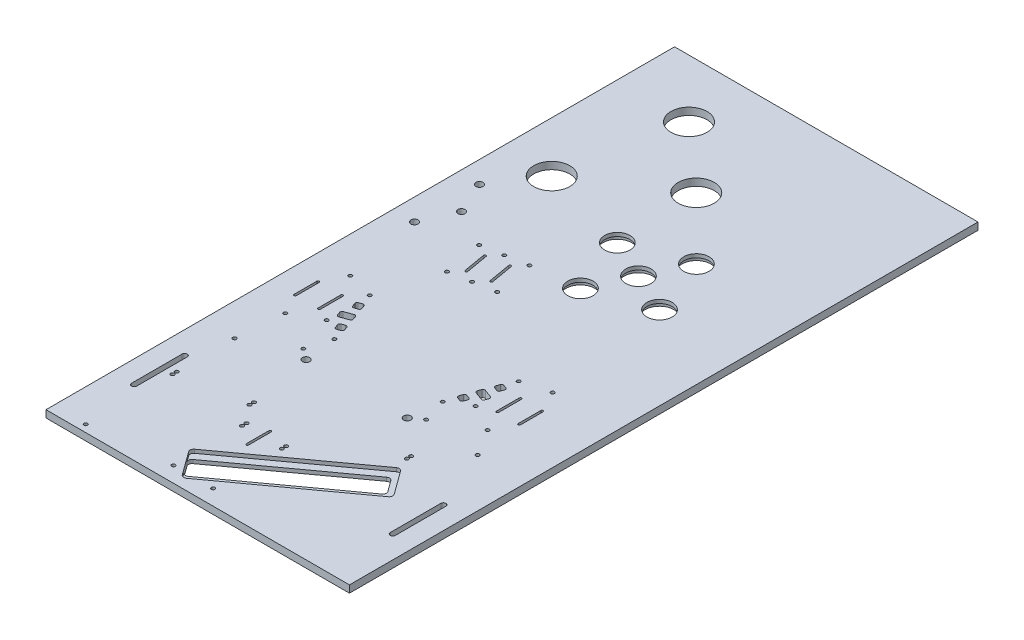
from build123d import *

# Parameters (mm, degrees)
SKETCH1_W                               = 533.4
SKETCH1_H                               = 1104.9
BOSS_EXTRUDE1_DEPTH                     = 12.7
LAUNCH_SYSTEM_MOUNTING_HOLES_AT_2_COUNT = 2
LAUNCH_SYSTEM_MOUNTING_HOLES_AT_2_PITCH = 44.45
LAUNCH_SYSTEM_MOUNTING_HOLES_AT_3_COUNT = 2
LAUNCH_SYSTEM_MOUNTING_HOLES_AT_3_PITCH = 88.9
LAUNCH_SYSTEM_MOUNTING_HOLES_AT_4_COUNT = 2
LAUNCH_SYSTEM_MOUNTING_HOLES_AT_4_PITCH = 94.399536545
LAUNCH_SYSTEM_MOUNTING_HOLES_AT_5_COUNT = 2
LAUNCH_SYSTEM_MOUNTING_HOLES_AT_5_PITCH = 54.624765446
LAUNCH_SYSTEM_MOUNTING_HOLES_AT_6_COUNT = 2
LAUNCH_SYSTEM_MOUNTING_HOLES_AT_6_PITCH = 31.761123779
CUT_EXTRUDE1_DEPTH                      = 1227.980382891
CUT_EXTRUDE2_DEPTH                      = 6.35
CUT_EXTRUDE3_DEPTH                      = 1227.931087103
SKETCH11_R                              = 6.35
CUT_EXTRUDE4_DEPTH                      = 1227.980382891
SKETCH13_R                              = 31.75
CUT_EXTRUDE5_DEPTH                      = 1227.980382891
SKETCH14_R                              = 3.175
CUT_EXTRUDE6_DEPTH                      = 1227.980382891
FILLET1_R                               = 3.175
SKETCH15_R                              = 3.175
CUT_EXTRUDE7_DEPTH                      = 1227.980382891
SKETCH16_R                              = 3.175
CUT_EXTRUDE8_DEPTH                      = 1227.980382891
SKETCH17_R                              = 3.175
CUT_EXTRUDE9_DEPTH                      = 1227.980382891
SKETCH18_R                              = 3.175
CUT_EXTRUDE10_DEPTH                     = 1227.980382891
SKETCH19_R                              = 3.175
CUT_EXTRUDE11_DEPTH                     = 1227.980382891
SKETCH20_R                              = 3.175
CUT_EXTRUDE12_DEPTH                     = 1227.980382891
SKETCH21_R                              = 6.35
CUT_EXTRUDE13_DEPTH                     = 1227.980382891
SKETCH22_R                              = 22.225
CUT_EXTRUDE14_DEPTH                     = 1227.980382891
SKETCH23_R                              = 25.4
CUT_EXTRUDE15_DEPTH                     = 6.35
CUT_EXTRUDE16_DEPTH                     = 22.098
CUT_EXTRUDE17_DEPTH                     = 1227.980382891
CUT_EXTRUDE18_DEPTH                     = 72.136
CUT_EXTRUDE19_DEPTH                     = 72.136
SKETCH28_R                              = 3.175
CUT_EXTRUDE20_DEPTH                     = 28.194


with BuildPart() as part:
    # Sketch1 → Boss-Extrude1 (new body)
    with BuildSketch(Plane(origin=(0, 0, 0), x_dir=(1, 0, 0), z_dir=(0, 1, 0))):
        with Locations((266.7, 552.45)):
            Rectangle(SKETCH1_W, SKETCH1_H)
    extrude(amount=BOSS_EXTRUDE1_DEPTH)

    # Sketch5 → Launch system mounting holes (revolve, cut)
    with BuildSketch(Plane(origin=(509.905, 0, -19.05), x_dir=(0, 0, -1), z_dir=(1, 0, 0))):
        Polygon((0, 0), (0, 11.705806461), (1.7272, 10.668), (1.7272, 0), align=None)
    launch_system_mounting_holes = revolve(axis=Axis((509.905, -6.35, -19.05), (0, 1, 0)), mode=Mode.SUBTRACT)

    # Launch system mounting holes at 2: Launch system mounting holes ×2
    with Locations(*[(0, 0, -i * LAUNCH_SYSTEM_MOUNTING_HOLES_AT_2_PITCH) for i in range(1, LAUNCH_SYSTEM_MOUNTING_HOLES_AT_2_COUNT)]):
        add(launch_system_mounting_holes, mode=Mode.SUBTRACT)

    # Launch system mounting holes at 3: Launch system mounting holes ×2
    with Locations(*[(0, 0, -i * LAUNCH_SYSTEM_MOUNTING_HOLES_AT_3_PITCH) for i in range(1, LAUNCH_SYSTEM_MOUNTING_HOLES_AT_3_COUNT)]):
        add(launch_system_mounting_holes, mode=Mode.SUBTRACT)

    # Launch system mounting holes at 4: Launch system mounting holes ×2
    with Locations(*[Vector(-0.3363363969981552, 0, -0.9417419115948379) * (i * LAUNCH_SYSTEM_MOUNTING_HOLES_AT_4_PITCH) for i in range(1, LAUNCH_SYSTEM_MOUNTING_HOLES_AT_4_COUNT)]):
        add(launch_system_mounting_holes, mode=Mode.SUBTRACT)

    # Launch system mounting holes at 5: Launch system mounting holes ×2
    with Locations(*[Vector(-0.5812381937190976, 0, -0.8137334712067341) * (i * LAUNCH_SYSTEM_MOUNTING_HOLES_AT_5_PITCH) for i in range(1, LAUNCH_SYSTEM_MOUNTING_HOLES_AT_5_COUNT)]):
        add(launch_system_mounting_holes, mode=Mode.SUBTRACT)

    # Launch system mounting holes at 6: Launch system mounting holes ×2
    with Locations(*[Vector(-0.9996497674567271, 0, -0.026463983519332806) * (i * LAUNCH_SYSTEM_MOUNTING_HOLES_AT_6_PITCH) for i in range(1, LAUNCH_SYSTEM_MOUNTING_HOLES_AT_6_COUNT)]):
        add(launch_system_mounting_holes, mode=Mode.SUBTRACT)

    # Sketch6 → Cut-Extrude1 (cut, through all)
    with BuildSketch(Plane(origin=(0, 0, 0), x_dir=(-1, 0, 0), z_dir=(0, -1, 0))):
        with BuildLine():
            Line((-498.475, 115.57), (-498.475, 204.47))
            ThreePointArc((-498.475, 204.47), (-494.03, 208.915), (-489.585, 204.47))
            Line((-489.585, 204.47), (-489.585, 115.57))
            ThreePointArc((-489.585, 115.57), (-494.03, 111.125), (-498.475, 115.57))
        make_face()
    cut_extrude1 = extrude(amount=-CUT_EXTRUDE1_DEPTH, mode=Mode.SUBTRACT)

    # Sketch9 → Cut-Extrude2 (cut)
    with BuildSketch(Plane(origin=(0, 12.7, 0), x_dir=(1, 0, 0), z_dir=(0, 1, 0))):
        with BuildLine():
            Line((396.125138133, 219.720033225), (190.634821562, 70.422579143))
            ThreePointArc((190.634821562, 70.422579143), (188.095436952, 66.278680082), (189.23, 61.552884876))
            Line((189.23, 61.552884876), (219.089490816, 20.454821562))
            ThreePointArc((219.089490816, 20.454821562), (223.233389878, 17.915436952), (227.959185083, 19.05))
            Line((227.959185083, 19.05), (433.449501654, 168.347454082))
            ThreePointArc((433.449501654, 168.347454082), (435.988886265, 172.491353144), (434.854323216, 177.217148349))
            Line((434.854323216, 177.217148349), (404.9948324, 218.315211663))
            ThreePointArc((404.9948324, 218.315211663), (400.850933339, 220.854596274), (396.125138133, 219.720033225))
        make_face()
    extrude(amount=-CUT_EXTRUDE2_DEPTH, mode=Mode.SUBTRACT)

    # Sketch10 → Cut-Extrude3 (cut, through all)
    with BuildSketch(Plane(origin=(0, 6.35, 0), x_dir=(1, 0, 0), z_dir=(0, 1, 0))):
        with BuildLine():
            Line((197.068116339, 50.764643256), (211.251374477, 31.243063182))
            ThreePointArc((211.251374477, 31.243063182), (215.395273538, 28.703678571), (220.121068743, 29.83824162))
            Line((220.121068743, 29.83824162), (417.391772652, 173.163797539))
            ThreePointArc((417.391772652, 173.163797539), (419.931157263, 177.3076966), (418.796594214, 182.033491805))
            Line((418.796594214, 182.033491805), (404.613336076, 201.55507188))
            ThreePointArc((404.613336076, 201.55507188), (400.469437015, 204.09445649), (395.74364181, 202.959893442))
            Line((395.74364181, 202.959893442), (198.472937902, 59.634337523))
            ThreePointArc((198.472937902, 59.634337523), (195.933553291, 55.490438462), (197.068116339, 50.764643256))
        make_face()
    extrude(amount=-CUT_EXTRUDE3_DEPTH, mode=Mode.SUBTRACT)

    # Sketch11 → Cut-Extrude4 (cut, through all)
    with BuildSketch(Plane(origin=(0, 12.7, 0), x_dir=(1, 0, 0), z_dir=(0, 1, 0))):
        with Locations(Location((152.4, 304.8, 0), (0, 0, 270))):
            Circle(SKETCH11_R)
        with Locations(Location((330.2, 304.8, 0), (0, 0, 270))):
            Circle(SKETCH11_R)
    extrude(amount=-CUT_EXTRUDE4_DEPTH, mode=Mode.SUBTRACT)

    # Sketch13 → Cut-Extrude5 (cut, through all)
    with BuildSketch(Plane(origin=(0, 12.7, 0), x_dir=(1, 0, 0), z_dir=(0, 1, 0))):
        with Locations(Location((127, 1003.3, 0), (0, 0, 270))):
            Circle(SKETCH13_R)
        with Locations(Location((241.3, 901.7, 0), (0, 0, 270))):
            Circle(SKETCH13_R)
        with Locations(Location((88.9, 800.1, 0), (0, 0, 270))):
            Circle(SKETCH13_R)
    extrude(amount=-CUT_EXTRUDE5_DEPTH, mode=Mode.SUBTRACT)

    # Sketch14 → Cut-Extrude6 (cut, through all)
    with BuildSketch(Plane(origin=(0, 12.7, 0), x_dir=(1, 0, 0), z_dir=(0, 1, 0))):
        with Locations(Location((146.05, 360.819531991, 0), (0, 0, 270))):
            Circle(SKETCH14_R)
        with Locations(Location((110.432022274, 382.994798341, 0), (0, 0, 270))):
            Circle(SKETCH14_R)
        with Locations(Location((110.432022274, 458.679121519, 0), (0, 0, 270))):
            Circle(SKETCH14_R)
        with Locations(Location((372.167977726, 458.679121519, 0), (0, 0, 270))):
            Circle(SKETCH14_R)
        with Locations(Location((372.167977726, 382.994798341, 0), (0, 0, 270))):
            Circle(SKETCH14_R)
        with Locations(Location((336.55, 360.819531991, 0), (0, 0, 270))):
            Circle(SKETCH14_R)
        Polygon((142.083674759, 381), (130.149578475, 376.65634418), (125.805922654, 388.590440464), (137.740018938, 392.934096284), align=None)
        Polygon((129.052707298, 416.802288852), (133.396363118, 404.868192568), (113.108399435, 397.483977674), (108.764743615, 409.418073958), align=None)
        Polygon((124.709051478, 428.736385136), (112.774955194, 424.392729316), (108.431299373, 436.3268256), (120.365395657, 440.67048142), align=None)
        Polygon((374.168700627, 436.3268256), (362.234604343, 440.67048142), (357.890948522, 428.736385136), (369.825044806, 424.392729316), align=None)
        Polygon((353.547292702, 416.802288852), (349.203636882, 404.868192568), (369.491600565, 397.483977674), (373.835256385, 409.418073958), align=None)
        Polygon((344.859981062, 392.934096284), (340.516325241, 381), (352.450421525, 376.65634418), (356.794077346, 388.590440464), align=None)
    extrude(amount=-CUT_EXTRUDE6_DEPTH, mode=Mode.SUBTRACT)

    # Fillet1
    fillet1_edges = [part.edges().sort_by_distance(p)[0] for p in [
        (344.859981062, 6.35, -392.934096284),
        (356.794077346, 6.35, -388.590440464),
        (352.450421525, 6.35, -376.65634418),
        (340.516325241, 6.35, -381),
        (353.547292702, 6.35, -416.802288852),
        (373.835256385, 6.35, -409.418073958),
        (369.491600565, 6.35, -397.483977674),
        (349.203636882, 6.35, -404.868192568),
        (374.168700627, 6.35, -436.3268256),
        (369.825044806, 6.35, -424.392729316),
        (357.890948522, 6.35, -428.736385136),
        (362.234604343, 6.35, -440.67048142),
        (133.396363118, 6.35, -404.868192568),
        (113.108399435, 6.35, -397.483977674),
        (108.764743615, 6.35, -409.418073958),
        (129.052707298, 6.35, -416.802288852),
        (120.365395657, 6.35, -440.67048142),
        (124.709051478, 6.35, -428.736385136),
        (112.774955194, 6.35, -424.392729316),
        (108.431299373, 6.35, -436.3268256),
        (137.740018938, 6.35, -392.934096284),
        (142.083674759, 6.35, -381),
        (130.149578475, 6.35, -376.65634418),
        (125.805922654, 6.35, -388.590440464),
    ]]
    fillet(fillet1_edges, radius=FILLET1_R)

    # Sketch15 → Cut-Extrude7 (cut, through all)
    with BuildSketch(Plane(origin=(0, 12.7, 0), x_dir=(1, 0, 0), z_dir=(0, 1, 0))):
        with Locations(Location((63.5, 471.349841111, 0), (0, 0, 270))):
            Circle(SKETCH15_R)
        with Locations(Location((63.5, 357.049841111, 0), (0, 0, 270))):
            Circle(SKETCH15_R)
        with Locations(Location((133.35, 318.949841111, 0), (0, 0, 270))):
            Circle(SKETCH15_R)
        with Locations(Location((349.25, 318.949841111, 0), (0, 0, 270))):
            Circle(SKETCH15_R)
        with Locations(Location((419.1, 471.349841111, 0), (0, 0, 270))):
            Circle(SKETCH15_R)
        with Locations(Location((419.1, 357.049841111, 0), (0, 0, 270))):
            Circle(SKETCH15_R)
    extrude(amount=-CUT_EXTRUDE7_DEPTH, mode=Mode.SUBTRACT)

    # Mirror1: Launch system mounting holes, Cut-Extrude1 across plane
    add(launch_system_mounting_holes.mirror(Plane.ZY.offset(-266.7)), mode=Mode.SUBTRACT)
    add(cut_extrude1.mirror(Plane.ZY.offset(-266.7)), mode=Mode.SUBTRACT)

    # Mirror1 copy 1 sketch → Mirror1 copy 1 (revolve, cut)
    with BuildSketch(Plane(origin=(23.495, 0, -63.5), x_dir=(0, 0, -1), z_dir=(-1, 0, 0))):
        Polygon((0, 0), (0, -11.705806461), (1.7272, -10.668), (1.7272, 0), align=None)
    revolve(axis=Axis((23.495, -6.35, -63.5), (0, -1, 0)), mode=Mode.SUBTRACT)

    # Mirror1 copy 2 sketch → Mirror1 copy 2 (revolve, cut)
    with BuildSketch(Plane(origin=(23.495, 0, -107.95), x_dir=(0, 0, -1), z_dir=(-1, 0, 0))):
        Polygon((0, 0), (0, -11.705806461), (1.7272, -10.668), (1.7272, 0), align=None)
    revolve(axis=Axis((23.495, -6.35, -107.95), (0, -1, 0)), mode=Mode.SUBTRACT)

    # Mirror1 copy 3 sketch → Mirror1 copy 3 (revolve, cut)
    with BuildSketch(Plane(origin=(55.245, 0, -107.95), x_dir=(0, 0, -1), z_dir=(-1, 0, 0))):
        Polygon((0, 0), (0, -11.705806461), (1.7272, -10.668), (1.7272, 0), align=None)
    revolve(axis=Axis((55.245, -6.35, -107.95), (0, -1, 0)), mode=Mode.SUBTRACT)

    # Mirror1 copy 4 sketch → Mirror1 copy 4 (revolve, cut)
    with BuildSketch(Plane(origin=(55.245, 0, -63.5), x_dir=(0, 0, -1), z_dir=(-1, 0, 0))):
        Polygon((0, 0), (0, -11.705806461), (1.7272, -10.668), (1.7272, 0), align=None)
    revolve(axis=Axis((55.245, -6.35, -63.5), (0, -1, 0)), mode=Mode.SUBTRACT)

    # Mirror1 copy 5 sketch → Mirror1 copy 5 (revolve, cut)
    with BuildSketch(Plane(origin=(55.245, 0, -19.890525856), x_dir=(0, 0, -1), z_dir=(-1, 0, 0))):
        Polygon((0, 0), (0, -11.705806461), (1.7272, -10.668), (1.7272, 0), align=None)
    revolve(axis=Axis((55.245, -6.35, -19.890525856), (0, -1, 0)), mode=Mode.SUBTRACT)

    # Sketch16 → Cut-Extrude8 (cut, through all)
    with BuildSketch(Plane(origin=(0, 12.7, 0), x_dir=(1, 0, 0), z_dir=(0, 1, 0))):
        with Locations(Location((57.15, 12.7, 0), (0, 0, 270))):
            Circle(SKETCH16_R)
        with Locations(Location((57.15, 165.1, 0), (0, 0, 270))):
            Circle(SKETCH16_R)
        with Locations(Location((57.15, 172.72, 0), (0, 0, 270))):
            Circle(SKETCH16_R)
        with Locations(Location((57.15, 274.32, 0), (0, 0, 270))):
            Circle(SKETCH16_R)
        with Locations(Location((171.45, 193.998147432, 0), (0, 0, 270))):
            Circle(SKETCH16_R)
    extrude(amount=-CUT_EXTRUDE8_DEPTH, mode=Mode.SUBTRACT)

    # Sketch17 → Cut-Extrude9 (cut, through all)
    with BuildSketch(Plane(origin=(0, 12.7, 0), x_dir=(1, 0, 0), z_dir=(0, 1, 0))):
        with Locations(Location((196.85, 27.197784876, 0), (0, 0, 270))):
            Circle(SKETCH17_R)
        with Locations(Location((266.7, 27.197784876, 0), (0, 0, 270))):
            Circle(SKETCH17_R)
        with Locations(Location((266.7, 147.847784876, 0), (0, 0, 270))):
            Circle(SKETCH17_R)
        with Locations(Location((196.85, 147.847784876, 0), (0, 0, 270))):
            Circle(SKETCH17_R)
    extrude(amount=-CUT_EXTRUDE9_DEPTH, mode=Mode.SUBTRACT)

    # Sketch18 → Cut-Extrude10 (cut, through all)
    with BuildSketch(Plane(origin=(0, 12.7, 0), x_dir=(1, 0, 0), z_dir=(0, 1, 0))):
        with Locations(Location((171.45, 186.378147432, 0), (0, 0, 270))):
            Circle(SKETCH18_R)
        with Locations(Location((196.85, 155.467784876, 0), (0, 0, 270))):
            Circle(SKETCH18_R)
    extrude(amount=-CUT_EXTRUDE10_DEPTH, mode=Mode.SUBTRACT)

    # Sketch19 → Cut-Extrude11 (cut, through all)
    with BuildSketch(Plane(origin=(0, 12.7, 0), x_dir=(1, 0, 0), z_dir=(0, 1, 0))):
        with Locations(Location((266.7, 155.467784876, 0), (0, 0, 270))):
            Circle(SKETCH19_R)
        with Locations(Location((391.709005004, 242.63720995, 0), (0, 0, 270))):
            Circle(SKETCH19_R)
    extrude(amount=-CUT_EXTRUDE11_DEPTH, mode=Mode.SUBTRACT)

    # Sketch20 → Cut-Extrude12 (cut, through all)
    with BuildSketch(Plane(origin=(0, 12.7, 0), x_dir=(1, 0, 0), z_dir=(0, 1, 0))):
        with Locations(Location((391.709005004, 250.25720995, 0), (0, 0, 270))):
            Circle(SKETCH20_R)
        with Locations(Location((448.31, 310.347391057, 0), (0, 0, 270))):
            Circle(SKETCH20_R)
    extrude(amount=-CUT_EXTRUDE12_DEPTH, mode=Mode.SUBTRACT)

    # Sketch21 → Cut-Extrude13 (cut, through all)
    with BuildSketch(Plane(origin=(0, 12.7, 0), x_dir=(1, 0, 0), z_dir=(0, 1, 0))):
        with Locations(Location((38.1, 723.9, 0), (0, 0, 270))):
            Circle(SKETCH21_R)
        with Locations(Location((38.1, 609.6, 0), (0, 0, 270))):
            Circle(SKETCH21_R)
        with Locations(Location((63.5, 666.75, 0), (0, 0, 270))):
            Circle(SKETCH21_R)
    extrude(amount=-CUT_EXTRUDE13_DEPTH, mode=Mode.SUBTRACT)

    # Sketch22 → Cut-Extrude14 (cut, through all)
    with BuildSketch(Plane(origin=(0, 12.7, 0), x_dir=(1, 0, 0), z_dir=(0, 1, 0))):
        with Locations(Location((247.978942272, 756.318201622, 0), (0, 0, 270))):
            Circle(SKETCH22_R)
        with Locations(Location((285.081798378, 654.378942272, 0), (0, 0, 270))):
            Circle(SKETCH22_R)
        with Locations(Location((317.5, 723.9, 0), (0, 0, 270))):
            Circle(SKETCH22_R)
        with Locations(Location((387.021057728, 691.481798378, 0), (0, 0, 270))):
            Circle(SKETCH22_R)
        with Locations(Location((349.918201622, 793.421057728, 0), (0, 0, 270))):
            Circle(SKETCH22_R)
    extrude(amount=-CUT_EXTRUDE14_DEPTH, mode=Mode.SUBTRACT)

    # Sketch23 → Cut-Extrude15 (cut)
    with BuildSketch(Plane(origin=(0, 0, 0), x_dir=(-1, 0, 0), z_dir=(0, -1, 0))):
        with Locations(Location((-317.5, 723.9, 0), (0, 0, 90))):
            Circle(SKETCH23_R)
        with Locations(Location((-349.918201622, 793.421057728, 0), (0, 0, 90))):
            Circle(SKETCH23_R)
        with Locations(Location((-247.978942272, 756.318201622, 0), (0, 0, 90))):
            Circle(SKETCH23_R)
        with Locations(Location((-285.081798378, 654.378942272, 0), (0, 0, 90))):
            Circle(SKETCH23_R)
        with Locations(Location((-387.021057728, 691.481798378, 0), (0, 0, 90))):
            Circle(SKETCH23_R)
    extrude(amount=-CUT_EXTRUDE15_DEPTH, mode=Mode.SUBTRACT)

    # Sketch24 → Cut-Extrude16 (cut)
    with BuildSketch(Plane(origin=(0, 12.7, 0), x_dir=(1, 0, 0), z_dir=(0, 1, 0))):
        with BuildLine():
            Line((227.869999936, 124.072826767), (227.869999936, 164.072826777))
            ThreePointArc((227.869999936, 164.072826777), (229.87, 166.072826841), (231.870000064, 164.072826777))
            Line((231.870000064, 164.072826777), (231.870000064, 124.072826767))
            ThreePointArc((231.870000064, 124.072826767), (229.87, 122.072826703), (227.869999936, 124.072826767))
        make_face()
    extrude(amount=-CUT_EXTRUDE16_DEPTH, mode=Mode.SUBTRACT)

    # Sketch25 → Cut-Extrude17 (cut, through all)
    with BuildSketch(Plane(origin=(0, 12.7, 0), x_dir=(1, 0, 0), z_dir=(0, 1, 0))):
        with BuildLine():
            Line((46.450000064, 433.70000001), (46.450000064, 393.7))
            ThreePointArc((46.450000064, 393.7), (44.45, 391.699999936), (42.449999936, 393.7))
            Line((42.449999936, 393.7), (42.449999936, 433.70000001))
            ThreePointArc((42.449999936, 433.70000001), (44.45, 435.700000074), (46.450000064, 433.70000001))
        make_face()
    extrude(amount=-CUT_EXTRUDE17_DEPTH, mode=Mode.SUBTRACT)

    # Sketch26 → Cut-Extrude18 (cut)
    with BuildSketch(Plane(origin=(0, 12.7, 0), x_dir=(1, 0, 0), z_dir=(0, 1, 0))):
        with BuildLine():
            Line((88.360000064, 433.70000001), (88.360000064, 393.7))
            ThreePointArc((88.360000064, 393.7), (86.36, 391.699999936), (84.359999936, 393.7))
            Line((84.359999936, 393.7), (84.359999936, 433.70000001))
            ThreePointArc((84.359999936, 433.70000001), (86.36, 435.700000074), (88.360000064, 433.70000001))
        make_face()
    extrude(amount=-CUT_EXTRUDE18_DEPTH, mode=Mode.SUBTRACT)

    # Sketch27 → Cut-Extrude19 (cut)
    with BuildSketch(Plane(origin=(0, 12.7, 0), x_dir=(1, 0, 0), z_dir=(0, 1, 0))):
        with BuildLine():
            Line((440.150000064, 433.70000001), (440.150000064, 393.7))
            ThreePointArc((440.150000064, 393.7), (438.15, 391.699999936), (436.149999936, 393.7))
            Line((436.149999936, 393.7), (436.149999936, 433.70000001))
            ThreePointArc((436.149999936, 433.70000001), (438.15, 435.700000074), (440.150000064, 433.70000001))
        make_face()
        with BuildLine():
            Line((402.050000064, 433.70000001), (402.050000064, 393.7))
            ThreePointArc((402.050000064, 393.7), (400.05, 391.699999936), (398.049999936, 393.7))
            Line((398.049999936, 393.7), (398.049999936, 433.70000001))
            ThreePointArc((398.049999936, 433.70000001), (400.05, 435.700000074), (402.050000064, 433.70000001))
        make_face()
    extrude(amount=-CUT_EXTRUDE19_DEPTH, mode=Mode.SUBTRACT)

    # Sketch28 → Cut-Extrude20 (cut)
    with BuildSketch(Plane(origin=(0, 12.7, 0), x_dir=(1, 0, 0), z_dir=(0, 1, 0))):
        with Locations(Location((142.275431652, 562.47809758, 0), (0, 0, 270))):
            Circle(SKETCH28_R)
        with Locations(Location((130.146106442, 631.266919128, 0), (0, 0, 270))):
            Circle(SKETCH28_R)
        with Locations(Location((205.188457221, 644.498910266, 0), (0, 0, 270))):
            Circle(SKETCH28_R)
        with Locations(Location((217.317782431, 575.710088718, 0), (0, 0, 270))):
            Circle(SKETCH28_R)
        with Locations(Location((179.796607041, 569.094093149, 0), (0, 0, 270))):
            Circle(SKETCH28_R)
        with Locations(Location((167.667281831, 637.882914697, 0), (0, 0, 270))):
            Circle(SKETCH28_R)
        with BuildLine():
            Line((153.468008756, 620.22395757), (160.413935865, 580.83164744))
            ThreePointArc((160.413935865, 580.83164744), (158.791616662, 578.514735504), (156.474704727, 580.137054707))
            Line((156.474704727, 580.137054707), (149.528777618, 619.529364837))
            ThreePointArc((149.528777618, 619.529364837), (151.151096821, 621.846276773), (153.468008756, 620.22395757))
        make_face()
        with BuildLine():
            Line((190.989184146, 626.839953139), (197.935111255, 587.447643009))
            ThreePointArc((197.935111255, 587.447643009), (196.312792052, 585.130731073), (193.995880117, 586.753050276))
            Line((193.995880117, 586.753050276), (187.049953008, 626.145360406))
            ThreePointArc((187.049953008, 626.145360406), (188.672272211, 628.462272342), (190.989184146, 626.839953139))
        make_face()
    extrude(amount=-CUT_EXTRUDE20_DEPTH, mode=Mode.SUBTRACT)


solid = part.part
